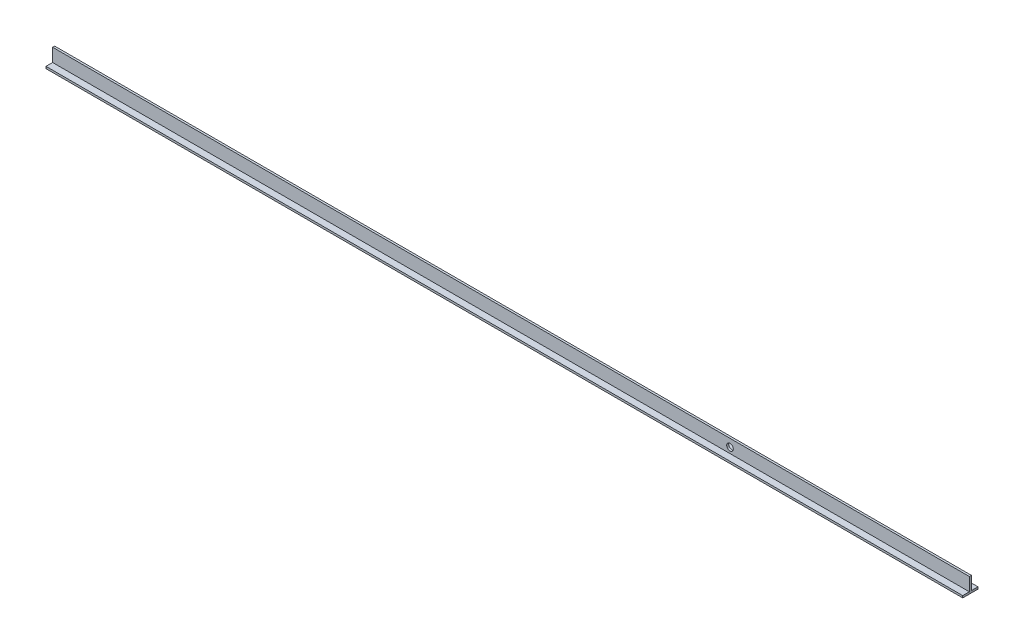
from build123d import *

# Parameters (mm, degrees)
CUSTOM_TE_30X30X4_1_DEPTH    = 1800
ENL_V_MAT_EXTRU_4_DEPTH      = 1332.925298206
ENL_V_MAT_EXTRU_4_DEPTH_BACK = 1332.925298206
ESQUISSE15_R                 = 6.5


with BuildPart() as part:
    # Esquisse11 → Custom TE_30X30X4(1) (new body)
    with BuildSketch(Plane.ZY.offset(-900)):
        Polygon((-15, 0), (15, 0), (15, 4), (2, 4), (2, 30), (-2, 30), (-2, 4), (-15, 4), align=None)
    extrude(amount=CUSTOM_TE_30X30X4_1_DEPTH)

    # Esquisse15 → Enlèv. mat.-Extru.4 (cut, two sides: drawn at the far end of the back side and taken through both)
    with BuildSketch(Plane(origin=(430, 0, 50), x_dir=(1, 0, 0), z_dir=(0, 0, 1)).offset(-ENL_V_MAT_EXTRU_4_DEPTH_BACK)):
        with Locations(Location((0, 15, 0), (0, 0, 270))):
            Circle(ESQUISSE15_R)
    extrude(amount=ENL_V_MAT_EXTRU_4_DEPTH + ENL_V_MAT_EXTRU_4_DEPTH_BACK, mode=Mode.SUBTRACT)


solid = part.part
